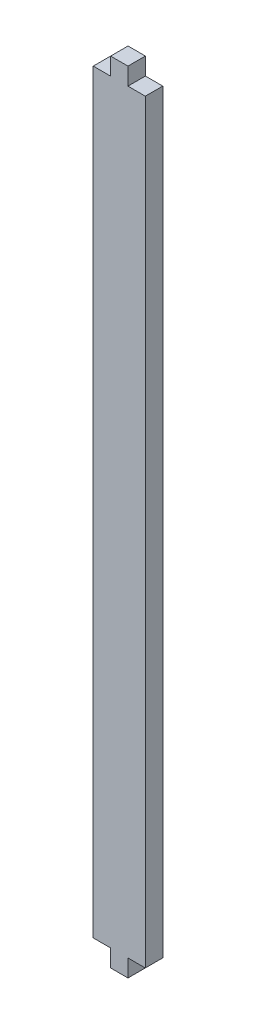
from build123d import *

# Parameters (mm, degrees)
SKETCH1_W           = 14.400000156
SKETCH1_H           = 218.44
BOSS_EXTRUDE1_DEPTH = 4.826
SKETCH2_W           = 4.800000052
SKETCH2_H           = 4.800000052
CUT_EXTRUDE1_DEPTH  = 219.967312356


with BuildPart() as part:
    # Sketch1 → Boss-Extrude1 (new body)
    with BuildSketch(Plane.XY):
        with Locations((7.200000078, 109.22)):
            Rectangle(SKETCH1_W, SKETCH1_H)
    extrude(amount=BOSS_EXTRUDE1_DEPTH)

    # Sketch2 → Cut-Extrude1 (cut, through all)
    with BuildSketch(Plane.XY.offset(4.826)):
        with Locations((2.400000026, 2.400000026)):
            Rectangle(SKETCH2_W, SKETCH2_H)
        with Locations((12.00000013, 2.400000026)):
            Rectangle(SKETCH2_W, SKETCH2_H)
        with Locations((2.400000026, 216.039999974)):
            Rectangle(SKETCH2_W, SKETCH2_H)
        with Locations((12.00000013, 216.039999974)):
            Rectangle(SKETCH2_W, SKETCH2_H)
    extrude(amount=-CUT_EXTRUDE1_DEPTH, mode=Mode.SUBTRACT)


solid = part.part
